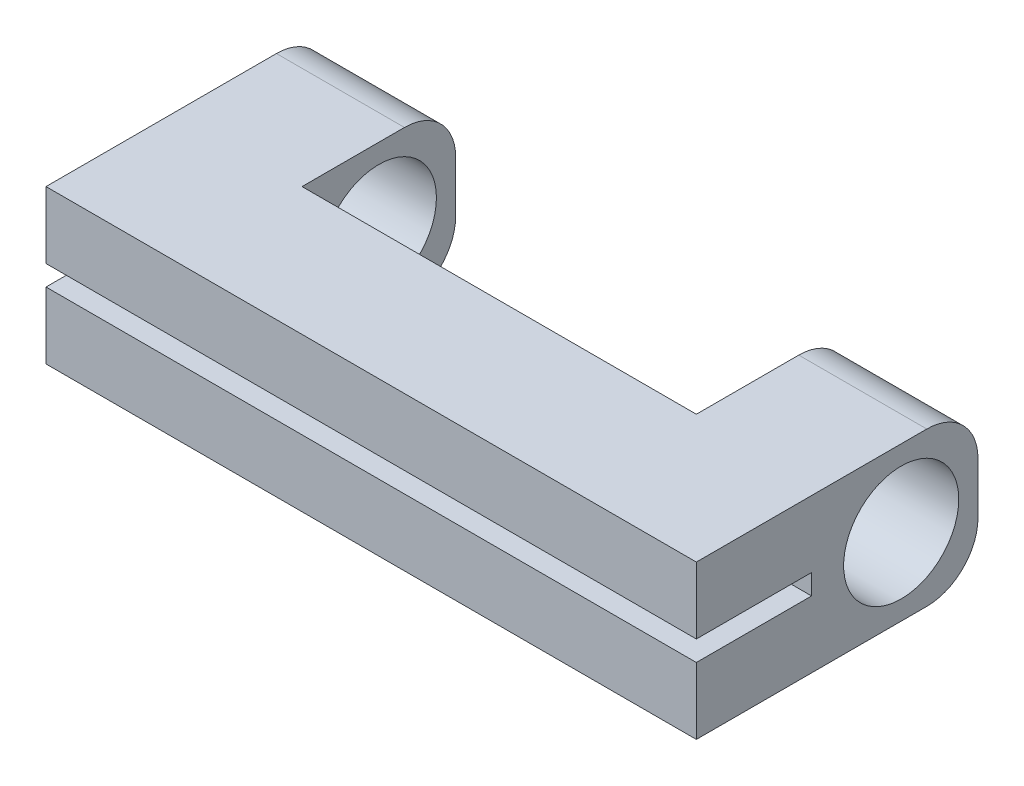
from build123d import *

# Parameters (mm, degrees)
SKETCH1_W             = 25.4
SKETCH1_H             = 5
BOSS_EXTRUDE1_DEPTH   = 6
SKETCH2_W             = 9
SKETCH2_H             = 0.79375
CUT_EXTRUDE1_DEPTH    = 27.218504915
SKETCH6_W             = 5
SKETCH6_H             = 6
BOSS_EXTRUDE2_DEPTH   = 6
F_8_CLEARANCE_HOLE1_D = 4.4958
FILLET1_R             = 2


with BuildPart() as part:
    # Sketch1 → Boss-Extrude1 (new body)
    with BuildSketch(Plane(origin=(0, 0, 0), x_dir=(1, 0, 0), z_dir=(0, 1, 0))):
        Rectangle(SKETCH1_W, SKETCH1_H)
    extrude(amount=BOSS_EXTRUDE1_DEPTH)

    # Sketch2 → Cut-Extrude1 (cut, through all)
    with BuildSketch(Plane(origin=(12.7, 0, 0), x_dir=(0, 0, -1), z_dir=(1, 0, 0))):
        with Locations((-2.5, 3)):
            Rectangle(SKETCH2_W, SKETCH2_H)
    extrude(amount=-CUT_EXTRUDE1_DEPTH, mode=Mode.SUBTRACT)

    # Sketch6 → Boss-Extrude2 (add)
    with BuildSketch(Plane(origin=(0, 0, -2.5), x_dir=(-1, 0, 0), z_dir=(0, 0, -1))):
        with Locations((10.2, 3)):
            Rectangle(SKETCH6_W, SKETCH6_H)
    extrude(amount=BOSS_EXTRUDE2_DEPTH)

    # #8 Clearance Hole1 (through all)
    with Locations(Plane(origin=(-7.7, 0, 0), x_dir=(0, 0, -1), z_dir=(1, 0, 0))):
        with Locations((5.5, 3)):
            Hole(F_8_CLEARANCE_HOLE1_D / 2)

    # Fillet1
    fillet1_edges = [part.edges().sort_by_distance(p)[0] for p in [
        (-10.2, 6, -8.5),
        (-10.2, 0, -8.5),
    ]]
    fillet(fillet1_edges, radius=FILLET1_R)

    # Mirror1: part across plane


with BuildPart() as part_1:
    add(part.part)
    add(part.part.mirror(Plane(origin=(0, 0, 0), x_dir=(0, 0, 1), z_dir=(1, 0, 0))))


solid = part_1.part
